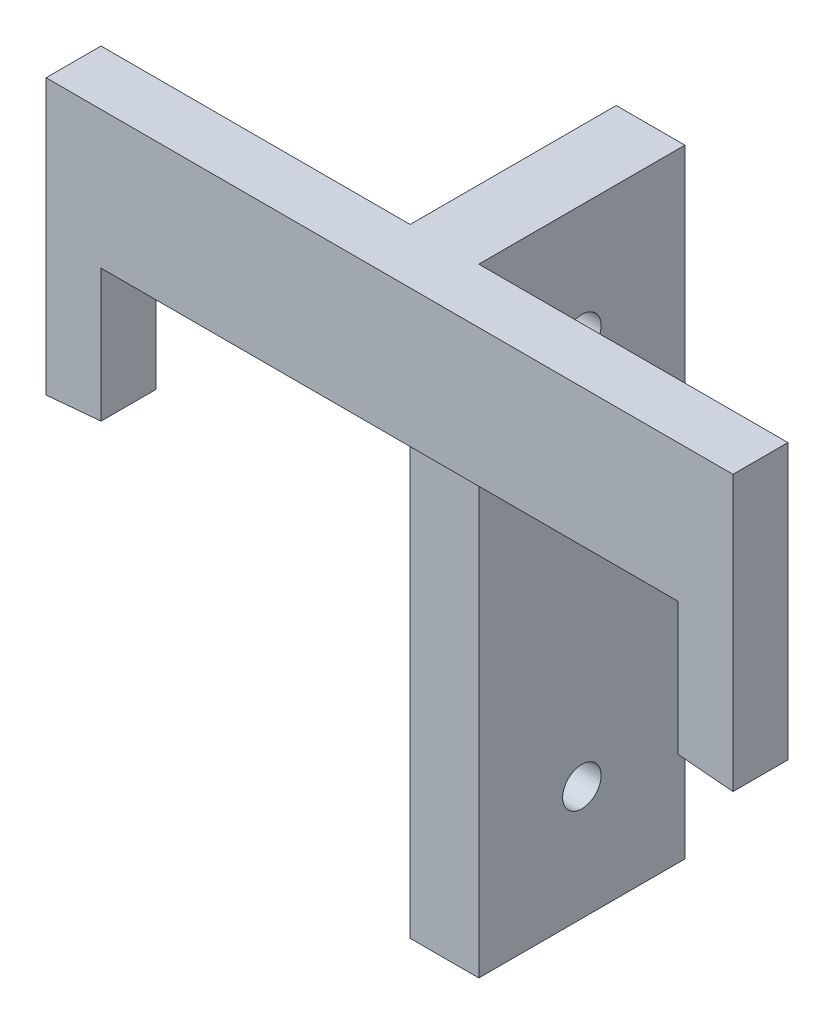
from build123d import *

# Parameters (mm, degrees)
SKETCH1_W           = 3.175
SKETCH1_H           = 28.575
BOSS_EXTRUDE1_DEPTH = 9.525
CUT_EXTRUDE1_REACH  = 19.462
SKETCH4_R           = 0.889
SKETCH5_W           = 3.175
SKETCH5_H           = 6.35
BOSS_EXTRUDE3_DEPTH = 2.54


with BuildPart() as part:
    # Sketch1 → Boss-Extrude1 (new body)
    with BuildSketch(Plane.XY):
        Rectangle(SKETCH1_W, SKETCH1_H)
    extrude(amount=BOSS_EXTRUDE1_DEPTH)

    # Sketch4 → Cut-Extrude1 (cut, up to next)
    with BuildSketch(Plane(origin=(1.5875, 0, 0), x_dir=(0, 0, -1), z_dir=(1, 0, 0)), mode=Mode.PRIVATE) as cut_extrude1_sk1:
        with Locations((-4.7625, -9.0043)):
            Circle(SKETCH4_R)
    cut_extrude1_tool1 = extrude(cut_extrude1_sk1.sketch, amount=-CUT_EXTRUDE1_REACH, mode=Mode.PRIVATE) & part.part
    # Sketch4 → Cut-Extrude1 (cut, up to next)
    with BuildSketch(Plane(origin=(1.5875, 0, 0), x_dir=(0, 0, -1), z_dir=(1, 0, 0)), mode=Mode.PRIVATE) as cut_extrude1_sk2:
        with Locations((-4.7625, 9.0043)):
            Circle(SKETCH4_R)
    cut_extrude1_tool2 = extrude(cut_extrude1_sk2.sketch, amount=-CUT_EXTRUDE1_REACH, mode=Mode.PRIVATE) & part.part
    add(cut_extrude1_tool1.solids().sort_by_distance((1.5875, -9.0043, 4.7625))[0], mode=Mode.SUBTRACT)
    add(cut_extrude1_tool2.solids().sort_by_distance((1.5875, 9.0043, 4.7625))[0], mode=Mode.SUBTRACT)

    # Sketch5 → Boss-Extrude3 (add)
    with BuildSketch(Plane.XY.offset(9.525)):
        Polygon((-1.5875, 7.9375), (-1.5875, 14.2875), (-15.875, 14.2875), (-15.875, 7.9375), (-13.335, 7.9375), align=None)
        with Locations((0, 11.1125)):
            Rectangle(SKETCH5_W, SKETCH5_H)
        Polygon((15.875, 7.9375), (15.875, 14.2875), (1.5875, 14.2875), (1.5875, 7.9375), (13.335, 7.9375), align=None)
        Polygon((15.875, 1.5875), (15.875, 7.9375), (13.335, 7.9375), (13.335, 1.809721205), align=None)
        Polygon((-13.335, 7.9375), (-15.875, 7.9375), (-15.875, 1.5875), (-13.335, 1.809721205), align=None)
    extrude(amount=BOSS_EXTRUDE3_DEPTH)


solid = part.part
